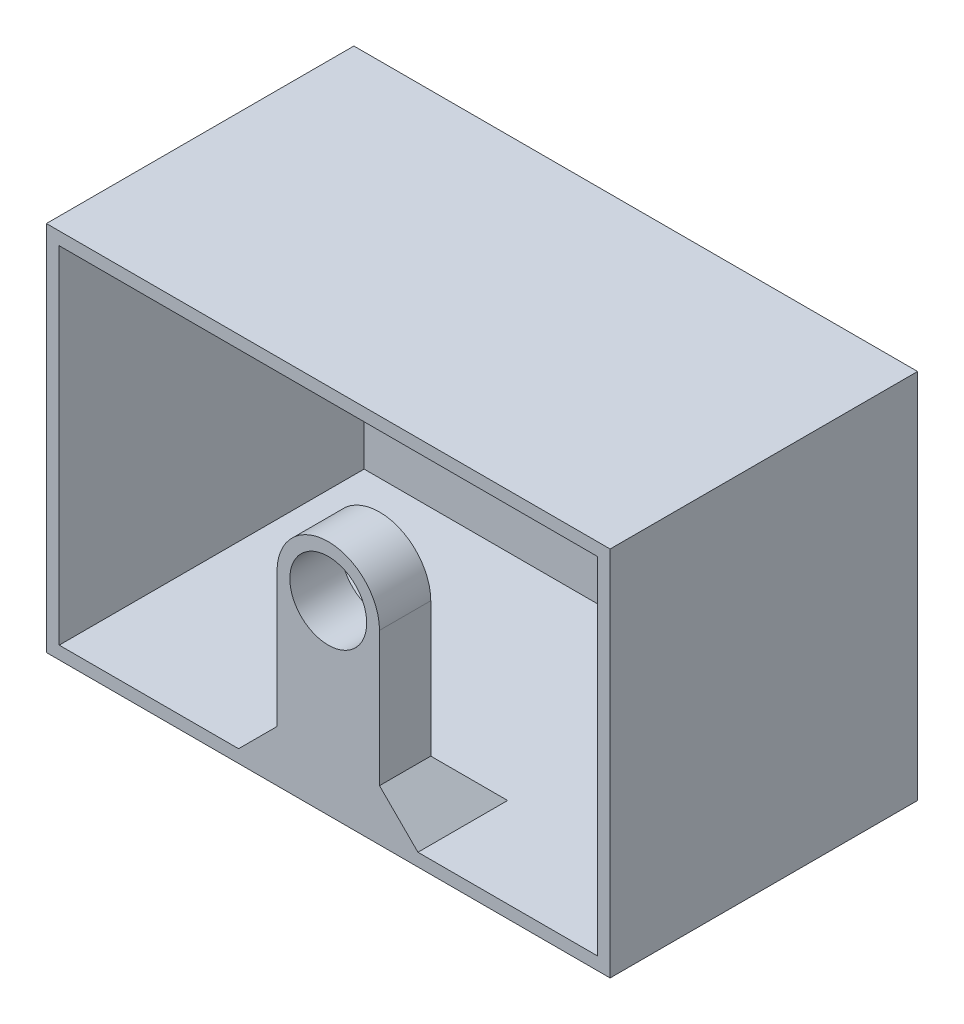
from build123d import *

# Parameters (mm, degrees)
ESBO_O1_W                = 220
ESBO_O1_H                = 145
ESBO_O1_W_2              = 210
ESBO_O1_H_2              = 135
RESSALTO_EXTRUS_O1_DEPTH = 60
ESBO_O3_W                = 210
ESBO_O3_H                = 135
ESBO_O3_R                = 15
RESSALTO_EXTRUS_O3_DEPTH = 1
RESSALTO_EXTRUS_O8_START = -20
ESBO_O14_R               = 15
RESSALTO_EXTRUS_O8_DEPTH = 20
CHANFRO4_SIZE            = 15


with BuildPart() as part:
    # Esboço1 → Ressalto-extrusão1 (new, symmetric)
    with BuildSketch(Plane.XY):
        Rectangle(ESBO_O1_W, ESBO_O1_H)
        Rectangle(ESBO_O1_W_2, ESBO_O1_H_2, mode=Mode.SUBTRACT)
    extrude(amount=RESSALTO_EXTRUS_O1_DEPTH, both=True)

    # Esboço3 → Ressalto-extrusão3 (add)
    with BuildSketch(Plane(origin=(0, 0, -60), x_dir=(-1, 0, 0), z_dir=(0, 0, -1))):
        Rectangle(ESBO_O3_W, ESBO_O3_H)
        Circle(ESBO_O3_R, mode=Mode.SUBTRACT)
    extrude(amount=-RESSALTO_EXTRUS_O3_DEPTH)

    # Esboço14 → Ressalto-extrusão8 (add)
    with BuildSketch(Plane.XY.offset(60).offset(RESSALTO_EXTRUS_O8_START)):
        with BuildLine():
            Line((-20, 0), (-20, -67.5))
            Line((-20, -67.5), (20, -67.5))
            Line((20, -67.5), (20, 0))
            ThreePointArc((20, 0), (0, 20), (-20, 0))
        make_face()
        with Locations(Location((0, 0, 0), (0, 0, 180))):
            Circle(ESBO_O14_R, mode=Mode.SUBTRACT)
    extrude(amount=RESSALTO_EXTRUS_O8_DEPTH)

    # Chanfro4
    chanfro4_edges = [part.edges().sort_by_distance(p)[0] for p in [
        (0, -67.5, 40),
        (20, -67.5, 50),
        (-20, -67.5, 50),
    ]]
    chamfer(chanfro4_edges, length=CHANFRO4_SIZE)


solid = part.part
